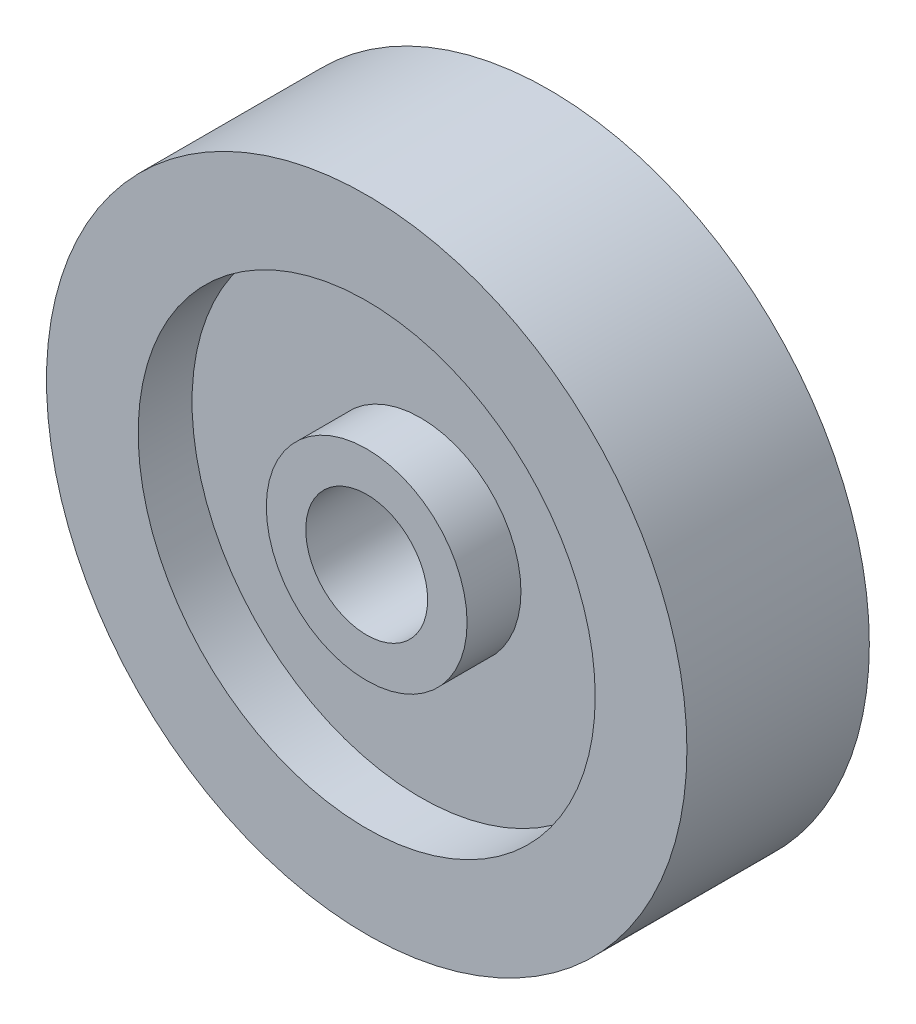
from build123d import *

# Parameters (mm, degrees)
SKETCH1_R           = 9.80909091
SKETCH1_R_2         = 1.8669
BOSS_EXTRUDE1_DEPTH = 2.794
SKETCH2_R           = 7
SKETCH2_R_2         = 3.075
CUT_EXTRUDE1_DEPTH  = 1.65


with BuildPart() as part:
    # Sketch1 → Boss-Extrude1 (new, symmetric)
    with BuildSketch(Plane.XY):
        Circle(SKETCH1_R)
        Circle(SKETCH1_R_2, mode=Mode.SUBTRACT)
    extrude(amount=BOSS_EXTRUDE1_DEPTH, both=True)

    # Sketch2 → Cut-Extrude1 (cut)
    with BuildSketch(Plane.XY.offset(2.794)):
        Circle(SKETCH2_R)
        Circle(SKETCH2_R_2, mode=Mode.SUBTRACT)
    cut_extrude1 = extrude(amount=-CUT_EXTRUDE1_DEPTH, mode=Mode.SUBTRACT)

    # Mirror1: Cut-Extrude1 across plane
    add(cut_extrude1.mirror(Plane.XY), mode=Mode.SUBTRACT)


solid = part.part
